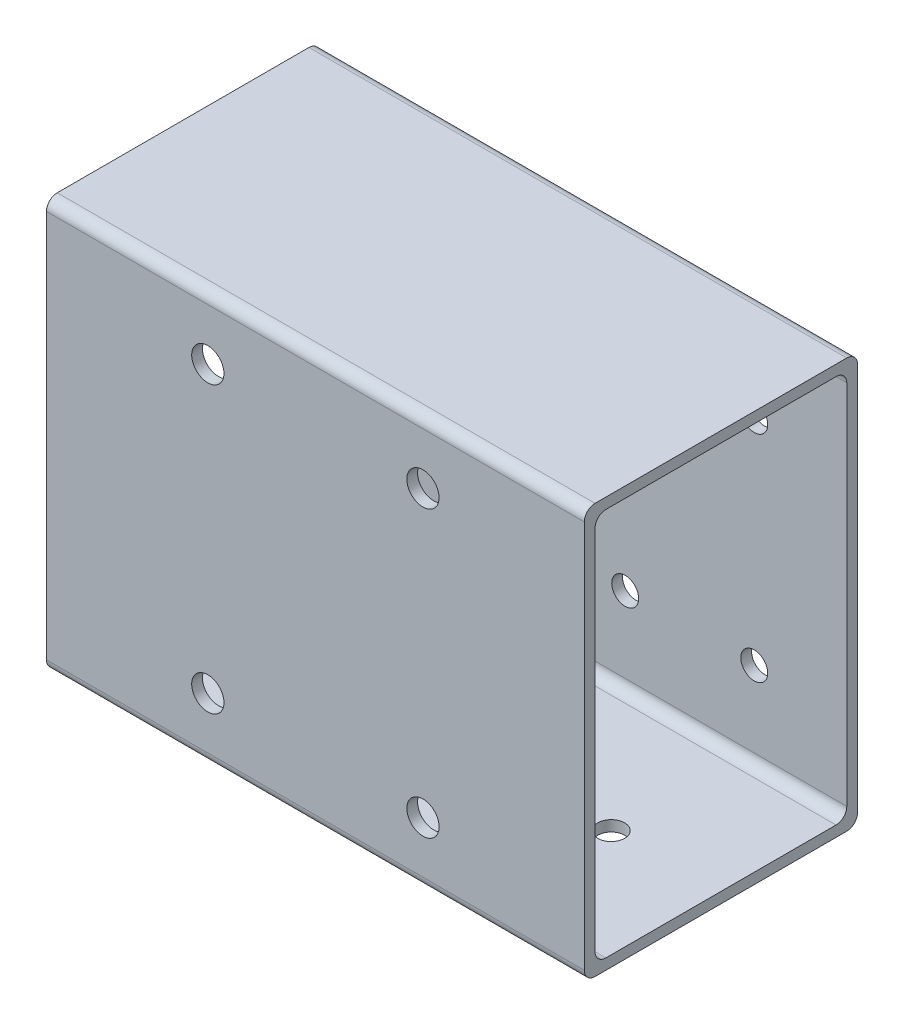
from build123d import *

# Parameters (mm, degrees)
SKETCH1_W             = 50.8
SKETCH1_H             = 76.2
BOSS_EXTRUDE1_DEPTH   = 100
SKETCH2_W             = 46.8
SKETCH2_H             = 72.2
CUT_EXTRUDE1_DEPTH    = 110.985317202
FILLET2_R             = 2
CORTAR_EXTRUIR2_DEPTH = 10
CROQUIS4_R            = 2.5
CORTAR_EXTRUIR5_DEPTH = 10
CROQUIS6_R            = 2.5
CORTAR_EXTRUIR6_DEPTH = 10
CROQUIS7_R            = 2.5
CORTAR_EXTRUIR7_DEPTH = 10


with BuildPart() as part:
    # Sketch1 → Boss-Extrude1 (new body)
    with BuildSketch(Plane(origin=(0, 0, 0), x_dir=(0, 0, -1), z_dir=(1, 0, 0))):
        Rectangle(SKETCH1_W, SKETCH1_H)
    extrude(amount=-BOSS_EXTRUDE1_DEPTH)

    # Sketch2 → Cut-Extrude1 (cut, through all)
    with BuildSketch(Plane(origin=(0, 0, 0), x_dir=(0, 0, -1), z_dir=(1, 0, 0))):
        Rectangle(SKETCH2_W, SKETCH2_H)
    extrude(amount=-CUT_EXTRUDE1_DEPTH, mode=Mode.SUBTRACT)

    # Fillet2
    fillet2_edges = [part.edges().sort_by_distance(p)[0] for p in [
        (-50, -36.1, 23.4),
        (-50, 36.1, 23.4),
        (-50, 36.1, -23.4),
        (-50, -36.1, -23.4),
        (-50, 38.1, 25.4),
        (-50, 38.1, -25.4),
        (-50, -38.1, -25.4),
        (-50, -38.1, 25.4),
    ]]
    fillet(fillet2_edges, radius=FILLET2_R)

    # Croquis2 → Cortar-Extruir2 (cut)
    with BuildSketch(Plane.XY.offset(25.4)):
        with BuildLine():
            ThreePointArc((-27, 26.5), (-30, 29.5), (-33, 26.5))
            Line((-33, 26.5), (-30, 26.5))
            Line((-30, 26.5), (-30, 23.5))
            ThreePointArc((-30, 23.5), (-27.878679656, 24.378679656), (-27, 26.5))
        make_face()
        with BuildLine():
            Line((-30, 26.5), (-33, 26.5))
            ThreePointArc((-33, 26.5), (-32.121320344, 24.378679656), (-30, 23.5))
            Line((-30, 23.5), (-30, 26.5))
        make_face()
        with BuildLine():
            ThreePointArc((-70, 23.5), (-67.878679656, 24.378679656), (-67, 26.5))
            Line((-67, 26.5), (-70, 26.5))
            Line((-70, 26.5), (-70, 23.5))
        make_face()
        with BuildLine():
            Line((-70, 26.5), (-67, 26.5))
            ThreePointArc((-67, 26.5), (-72.121320344, 28.621320344), (-70, 23.5))
            Line((-70, 23.5), (-70, 26.5))
        make_face()
        with BuildLine():
            ThreePointArc((-67, -26.5), (-67.878679656, -24.378679656), (-70, -23.5))
            Line((-70, -23.5), (-70, -26.5))
            Line((-70, -26.5), (-67, -26.5))
        make_face()
        with BuildLine():
            Line((-70, -26.5), (-70, -23.5))
            ThreePointArc((-70, -23.5), (-72.121320344, -28.621320344), (-67, -26.5))
            Line((-67, -26.5), (-70, -26.5))
        make_face()
        with BuildLine():
            ThreePointArc((-27, -26.5), (-27.878679656, -24.378679656), (-30, -23.5))
            Line((-30, -23.5), (-30, -26.5))
            Line((-30, -26.5), (-33, -26.5))
            ThreePointArc((-33, -26.5), (-30, -29.5), (-27, -26.5))
        make_face()
        with BuildLine():
            Line((-30, -26.5), (-30, -23.5))
            ThreePointArc((-30, -23.5), (-32.121320344, -24.378679656), (-33, -26.5))
            Line((-33, -26.5), (-30, -26.5))
        make_face()
    extrude(amount=-CORTAR_EXTRUIR2_DEPTH, mode=Mode.SUBTRACT)

    # Croquis4 → Cortar-Extruir5 (cut)
    with BuildSketch(Plane(origin=(0, 0, -25.4), x_dir=(-1, 0, 0), z_dir=(0, 0, -1))):
        with Locations(Location((90, 23.1, 0), (0, 0, 90))):
            Circle(CROQUIS4_R)
        with Locations(Location((59.2, 23.1, 0), (0, 0, 90))):
            Circle(CROQUIS4_R)
        with Locations(Location((59.2, -23.1, 0), (0, 0, 90))):
            Circle(CROQUIS4_R)
        with Locations(Location((90, -23.1, 0), (0, 0, 90))):
            Circle(CROQUIS4_R)
        with Locations(Location((74.6, 0, 0), (0, 0, 90))):
            Circle(CROQUIS4_R)
    extrude(amount=-CORTAR_EXTRUIR5_DEPTH, mode=Mode.SUBTRACT)

    # Croquis6 → Cortar-Extruir6 (cut)
    with BuildSketch(Plane(origin=(0, 0, -25.4), x_dir=(-1, 0, 0), z_dir=(0, 0, -1))):
        with Locations(Location((17.2, 20, 0), (0, 0, 90))):
            Circle(CROQUIS6_R)
        with Locations(Location((17.2, -20, 0), (0, 0, 90))):
            Circle(CROQUIS6_R)
        with Locations(Location((41.2, -20, 0), (0, 0, 90))):
            Circle(CROQUIS6_R)
        with Locations(Location((41.2, 20, 0), (0, 0, 90))):
            Circle(CROQUIS6_R)
    extrude(amount=-CORTAR_EXTRUIR6_DEPTH, mode=Mode.SUBTRACT)

    # Croquis7 → Cortar-Extruir7 (cut)
    with BuildSketch(Plane.XZ.offset(38.1)):
        with Locations(Location((-20, 0.4, 0), (0, 0, 270))):
            Circle(CROQUIS7_R)
        with Locations(Location((-80, 0.4, 0), (0, 0, 270))):
            Circle(CROQUIS7_R)
    extrude(amount=-CORTAR_EXTRUIR7_DEPTH, mode=Mode.SUBTRACT)


solid = part.part
